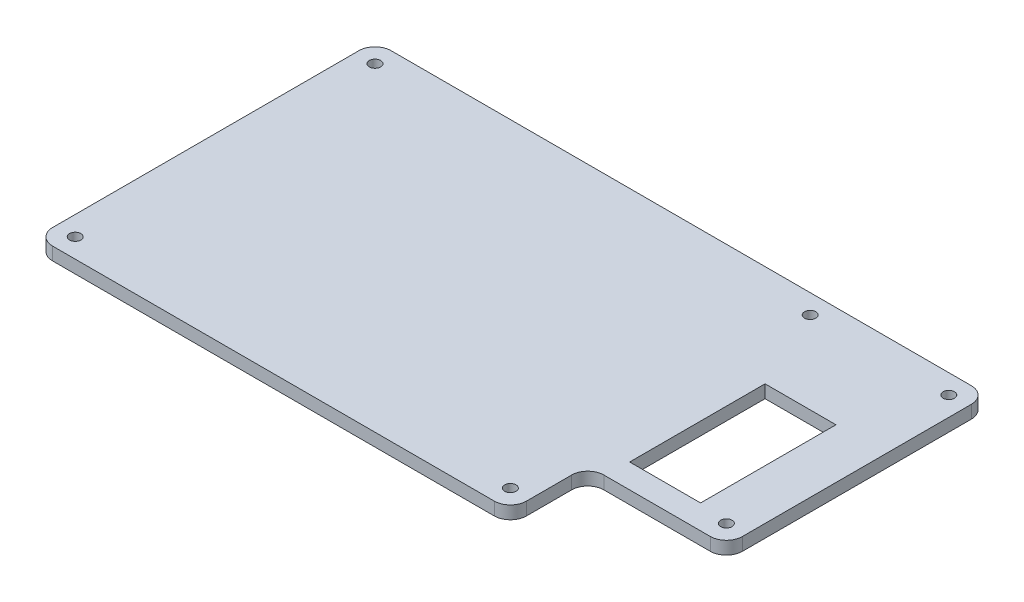
from build123d import *

# Parameters (mm, degrees)
SKETCH_1_R      = 1.75
SKETCH_1_W      = 22
SKETCH_1_H      = 42
EXTRUDE_1_DEPTH = 4
FILLET_1_R      = 5


with BuildPart() as part:
    # 草图1 → 凸台-拉伸1 (new body)
    with BuildSketch(Plane(origin=(0, 0, 0), x_dir=(1, 0, 0), z_dir=(0, 1, 0))):
        Polygon((-95, 52.5), (95, 52.5), (95, -28.5), (52, -28.5), (52, -52.5), (-95, -52.5), align=None)
        with Locations(Location((-89, -46.5, 0), (0, 0, 270))):
            Circle(SKETCH_1_R, mode=Mode.SUBTRACT)
        with Locations(Location((46, -46.5, 0), (0, 0, 270))):
            Circle(SKETCH_1_R, mode=Mode.SUBTRACT)
        with Locations(Location((46, 46.5, 0), (0, 0, 270))):
            Circle(SKETCH_1_R, mode=Mode.SUBTRACT)
        with Locations(Location((-89, 46.5, 0), (0, 0, 270))):
            Circle(SKETCH_1_R, mode=Mode.SUBTRACT)
        with Locations(Location((89, 46.5, 0), (0, 0, 270))):
            Circle(SKETCH_1_R, mode=Mode.SUBTRACT)
        with Locations(Location((89, -22.5, 0), (0, 0, 270))):
            Circle(SKETCH_1_R, mode=Mode.SUBTRACT)
        with Locations((68.5, 0)):
            Rectangle(SKETCH_1_W, SKETCH_1_H, mode=Mode.SUBTRACT)
    extrude(amount=EXTRUDE_1_DEPTH)

    # 圆角1
    fillet_1_edges = [part.edges().sort_by_distance(p)[0] for p in [
        (-95, 2, -52.5),
        (95, 2, -52.5),
        (95, 2, 28.5),
        (52, 2, 28.5),
        (52, 2, 52.5),
        (-95, 2, 52.5),
    ]]
    fillet(fillet_1_edges, radius=FILLET_1_R)


solid = part.part
